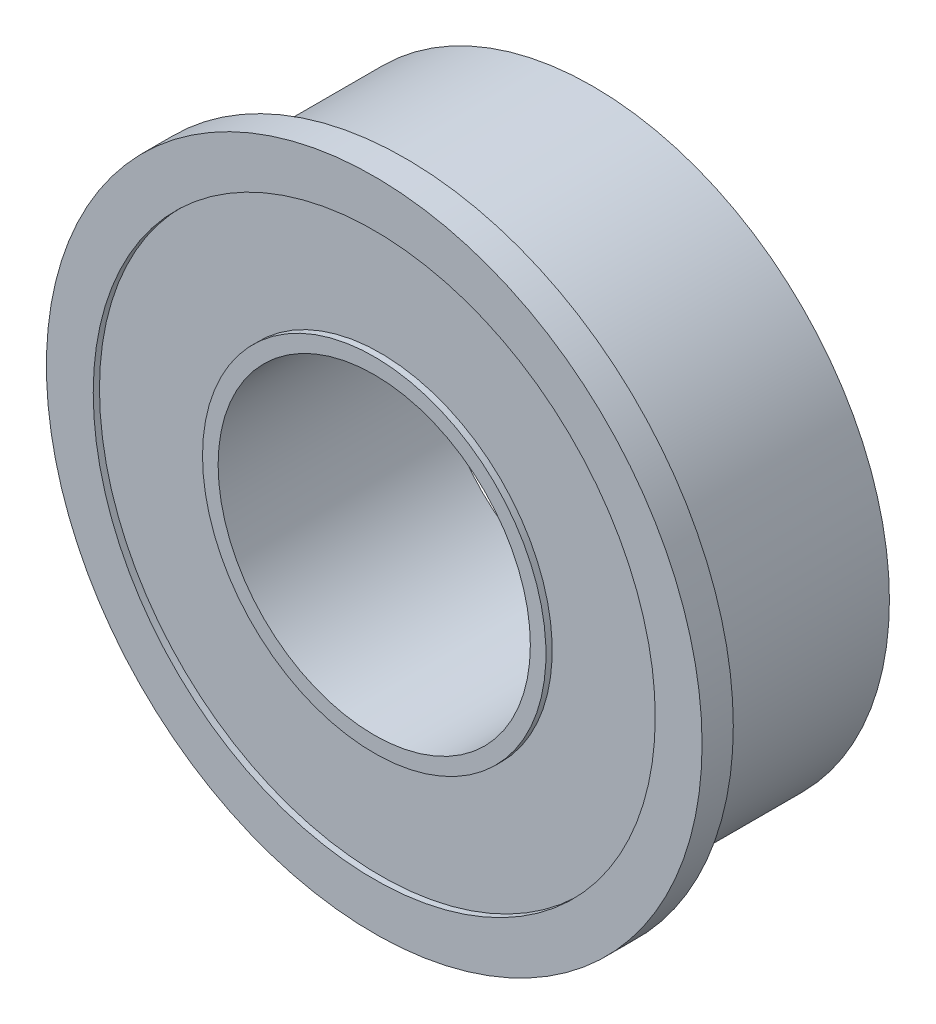
from build123d import *

# Parameters (mm, degrees)
SKETCH_1_R          = 10.5
SKETCH_1_R_2        = 9.5
EXTRUDE_1_DEPTH     = 1
EXTRUDE_START       = -7
SKETCH_2_R          = 9.5
SKETCH_2_R_2        = 5
EXTRUDE_2_DEPTH     = 7
SKETCH_3_R          = 9
SKETCH_3_R_2        = 5.5
CUT_EXTRUDE_1_DEPTH = 0.2


with BuildPart() as part:
    # 草图1 → 凸台-拉伸1 (new body)
    with BuildSketch(Plane.XY):
        Circle(SKETCH_1_R)
        Circle(SKETCH_1_R_2, mode=Mode.SUBTRACT)
    extrude(amount=EXTRUDE_1_DEPTH)

    # 草图2 → 凸台-拉伸2 (add)
    with BuildSketch(Plane.XY.offset(1).offset(EXTRUDE_START)):
        Circle(SKETCH_2_R)
        Circle(SKETCH_2_R_2, mode=Mode.SUBTRACT)
    extrude(amount=EXTRUDE_2_DEPTH)

    # 草图3 → 切除-拉伸1 (cut)
    with BuildSketch(Plane(origin=(0, 0, -6), x_dir=(-1, 0, 0), z_dir=(0, 0, -1))):
        Circle(SKETCH_3_R)
        Circle(SKETCH_3_R_2, mode=Mode.SUBTRACT)
    cut_extrude_1 = extrude(amount=-CUT_EXTRUDE_1_DEPTH, mode=Mode.SUBTRACT)

    # 镜向1: 切除-拉伸1 across plane
    add(cut_extrude_1.mirror(Plane(origin=(0, 0, -2.5), x_dir=(1, 0, 0), z_dir=(0, 0, -1))), mode=Mode.SUBTRACT)


solid = part.part
